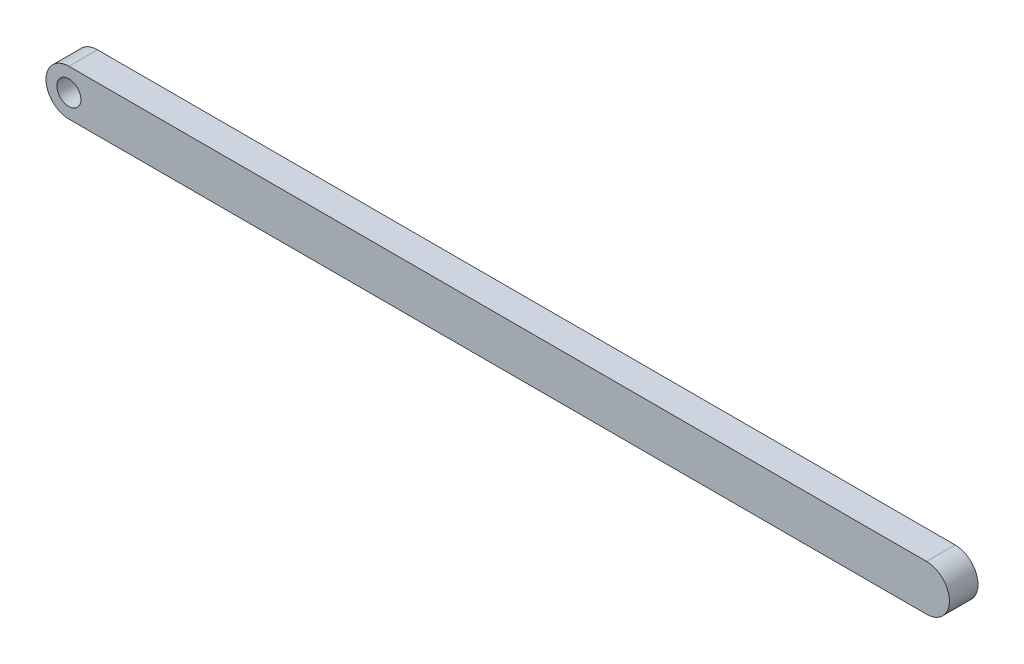
from build123d import *

# Parameters (mm, degrees)
SKETCH_1_R      = 2.1
EXTRUDE_1_DEPTH = 2.5


with BuildPart() as part:
    # 스케치1 → 보스-돌출1 (new, symmetric)
    with BuildSketch(Plane.XY):
        with BuildLine():
            Line((0, 4), (150, 4))
            ThreePointArc((150, 4), (154, 0), (150, -4))
            Line((150, -4), (0, -4))
            ThreePointArc((0, -4), (-4, 0), (0, 4))
        make_face()
        Circle(SKETCH_1_R, mode=Mode.SUBTRACT)
    extrude(amount=EXTRUDE_1_DEPTH, both=True)


solid = part.part
